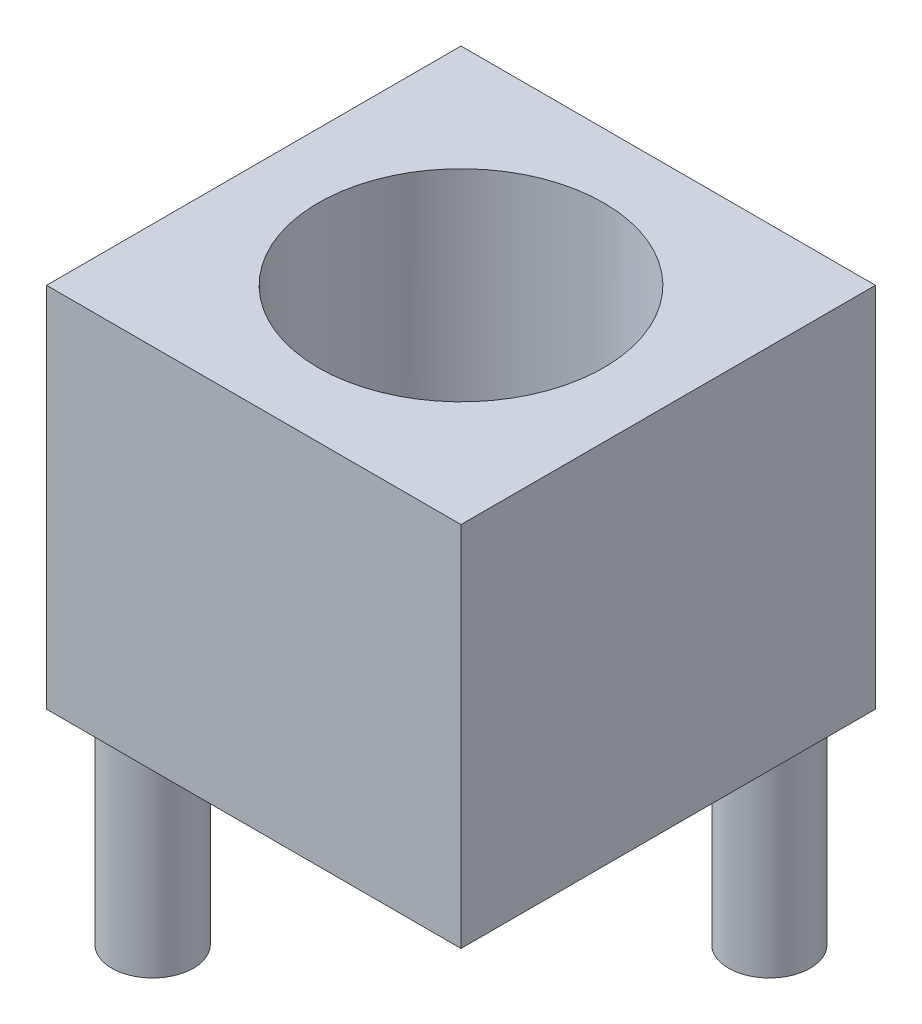
from build123d import *

# Parameters (mm, degrees)
SKETCH1_W           = 5.08
SKETCH1_H           = 5.08
SKETCH1_W_2         = 4
SKETCH1_H_2         = 2.5
BOSS_EXTRUDE1_DEPTH = 2
SKETCH2_W           = 5.08
SKETCH2_H           = 5.08
SKETCH2_R           = 1.75
BOSS_EXTRUDE2_DEPTH = 2.5
SKETCH1_3_R         = 0.5
BOSS_EXTRUDE3_DEPTH = 2.5


with BuildPart() as part:
    # Sketch1 → Boss-Extrude1 (new body)
    with BuildSketch(Plane(origin=(0, 0, 0), x_dir=(1, 0, 0), z_dir=(0, 1, 0))):
        Rectangle(SKETCH1_W, SKETCH1_H)
        Rectangle(SKETCH1_W_2, SKETCH1_H_2, mode=Mode.SUBTRACT)
    extrude(amount=BOSS_EXTRUDE1_DEPTH)

    # Sketch2 → Boss-Extrude2 (add)
    with BuildSketch(Plane(origin=(0, 2, 0), x_dir=(1, 0, 0), z_dir=(0, 1, 0))):
        Rectangle(SKETCH2_W, SKETCH2_H)
        Circle(SKETCH2_R, mode=Mode.SUBTRACT)
    extrude(amount=BOSS_EXTRUDE2_DEPTH)

    # Sketch1<3> → Boss-Extrude3 (add)
    with BuildSketch(Plane(origin=(0, 0, 0), x_dir=(1, 0, 0), z_dir=(0, 1, 0))):
        with Locations((-1.89, -1.89)):
            Circle(SKETCH1_3_R)
        with Locations((1.89, 1.89)):
            Circle(SKETCH1_3_R)
    extrude(amount=-BOSS_EXTRUDE3_DEPTH)


solid = part.part
